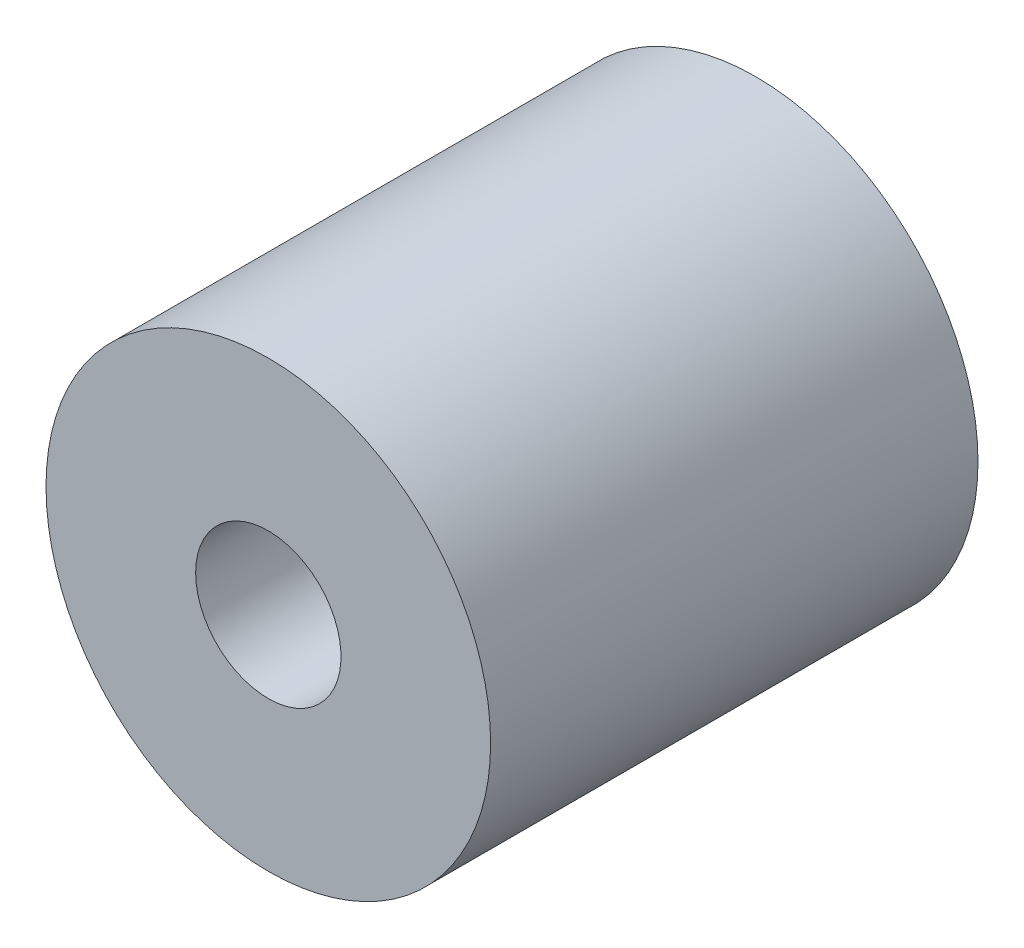
from build123d import *

# Parameters (mm, degrees)
SKETCH1_R           = 26
SKETCH1_R_2         = 8.5
BOSS_EXTRUDE1_DEPTH = 57


with BuildPart() as part:
    # Sketch1 → Boss-Extrude1 (new body)
    with BuildSketch(Plane.XY):
        with Locations(Location((0, 0, 0), (0, 0, 180))):
            Circle(SKETCH1_R)
        with Locations(Location((0, 0, 0), (0, 0, 180))):
            Circle(SKETCH1_R_2, mode=Mode.SUBTRACT)
    extrude(amount=BOSS_EXTRUDE1_DEPTH)


solid = part.part
